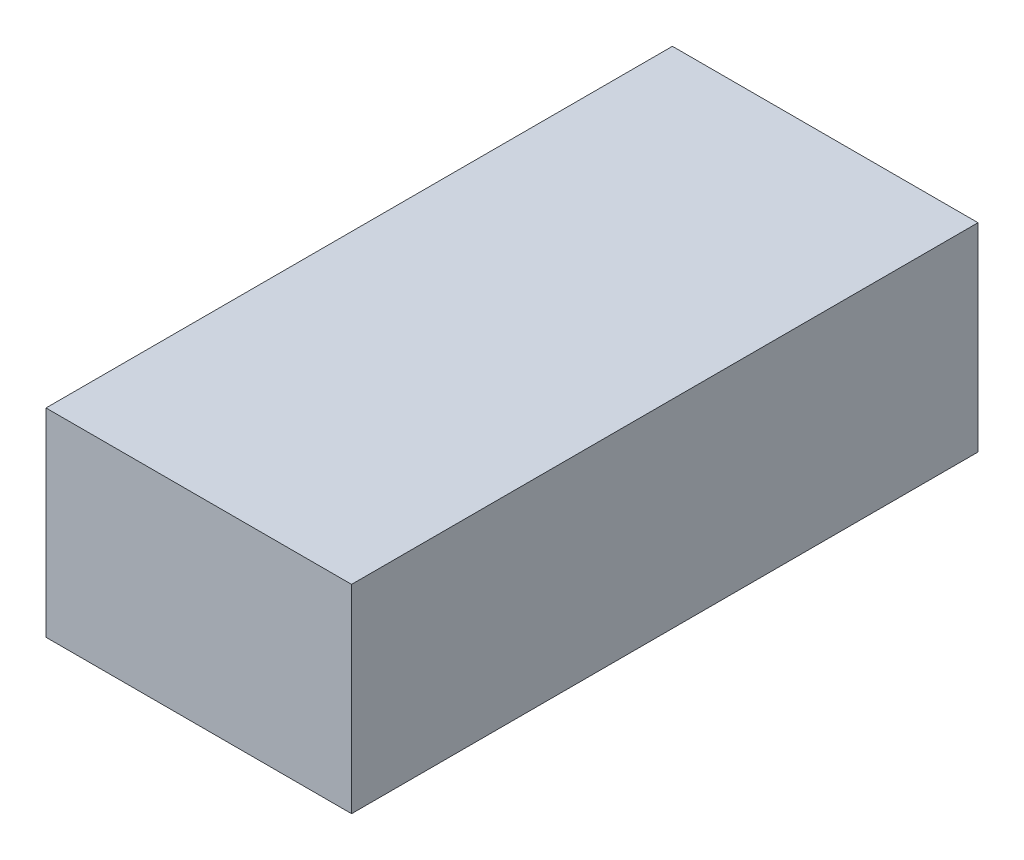
from build123d import *

# Parameters (mm, degrees)
SKETCH1_W           = 20
SKETCH1_H           = 41
BOSS_EXTRUDE1_DEPTH = 13


with BuildPart() as part:
    # Sketch1 → Boss-Extrude1 (new body)
    with BuildSketch(Plane(origin=(0, 0, 0), x_dir=(1, 0, 0), z_dir=(0, 1, 0))):
        Rectangle(SKETCH1_W, SKETCH1_H)
    extrude(amount=BOSS_EXTRUDE1_DEPTH)


solid = part.part
